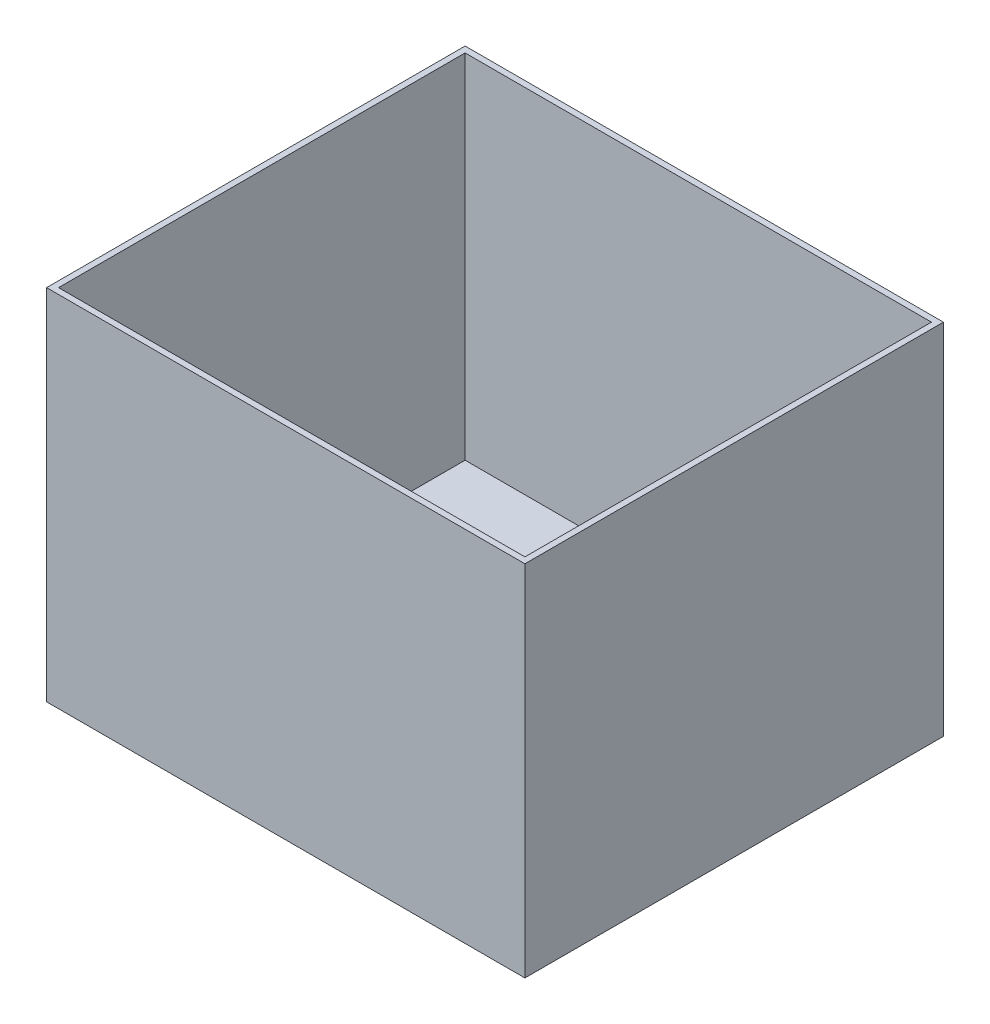
from build123d import *

# Parameters (mm, degrees)
SKETCH1_W           = 400
SKETCH1_H           = 350
BOSS_EXTRUDE1_DEPTH = 300
SHELL1_T            = -5


with BuildPart() as part:
    # Sketch1 → Boss-Extrude1 (new body)
    with BuildSketch(Plane(origin=(0, 0, 0), x_dir=(1, 0, 0), z_dir=(0, 1, 0))):
        with Locations((200, 175)):
            Rectangle(SKETCH1_W, SKETCH1_H)
    extrude(amount=BOSS_EXTRUDE1_DEPTH)

    # Shell1
    shell1_openings = [part.faces().sort_by_distance(p)[0] for p in [
        (200, 300, -175),
    ]]
    offset(amount=SHELL1_T, openings=shell1_openings, kind=Kind.INTERSECTION)


solid = part.part
